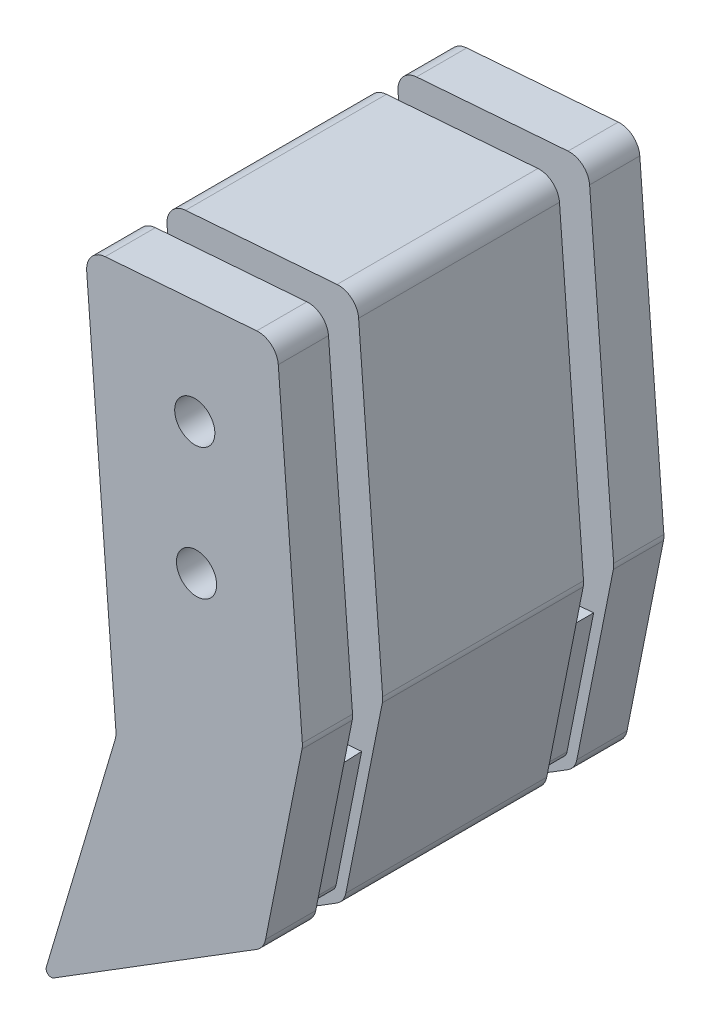
from build123d import *

# Parameters (mm, degrees)
EXTRUDE_1_DEPTH     = 36
SKETCH_2_W          = 16.133790568
SKETCH_2_H          = 36
EXTRUDE_2_DEPTH     = 6
EXTRUDE_3_DEPTH     = 36
FILLET_2_R          = 0.5
FILLET_4_R          = 2
CUT_EXTRUDE_START   = -4
CUT_EXTRUDE_1_DEPTH = 4
CUT_EXTRUDE_2_DEPTH = 60.648936936
CUT_EXTRUDE_4_DEPTH = 60.648936936
SKETCH_10_R         = 2
CUT_EXTRUDE_5_DEPTH = 292.913162357
SKETCH_11_R         = 2
EXTRUDE_6_DEPTH     = 1
EXTRUDE_START       = 1
SKETCH_12_R         = 2
EXTRUDE_7_DEPTH     = 1


with BuildPart() as part:
    # 草图1 → 凸台-拉伸1 (new body)
    with BuildSketch(Plane.XY):
        Polygon((299.097748252, 57.483280844), (301.735697168, 22.832042919), (294.730758259, 0), (313.442305989, 11.635922746), (317.295860503, 30.980257384), (315.184988901, 58.707979342), align=None)
    extrude(amount=EXTRUDE_1_DEPTH)

    # 草图2 → 凸台-拉伸2 (add)
    with BuildSketch(Plane(origin=(-2.627453617, 34.513375093, 0), x_dir=(0.9971147561793038, 0.07590891258269725, 0), z_dir=(-0.07590891258269725, 0.9971147561793038, 0))):
        with Locations((310.665166947, -18)):
            Rectangle(SKETCH_2_W, SKETCH_2_H)
    extrude(amount=EXTRUDE_2_DEPTH)

    # 草图3 → 凸台-拉伸3 (add)
    with BuildSketch(Plane.XY.offset(36)):
        Polygon((298.642294776, 63.465969381), (301.735697168, 22.832042919), (294.730758259, 0), (291.40566003, -2.067738419), (298.7443529, 22.604316182), (295.650950508, 63.238242643), align=None)
    extrude(amount=-EXTRUDE_3_DEPTH)

    # 圆角2
    fillet_2_edges = [part.edges().sort_by_distance(p)[0] for p in [
        (291.40566003, -2.067738419, 18),
    ]]
    fillet(fillet_2_edges, radius=FILLET_2_R)

    # 圆角4
    fillet_4_edges = [part.edges().sort_by_distance(p)[0] for p in [
        (317.295860503, 30.980257384, 18),
        (313.442305989, 11.635922746, 18),
        (314.729535426, 64.690667879, 18),
        (298.7443529, 22.604316182, 18),
        (295.650950508, 63.238242643, 18),
    ]]
    fillet(fillet_4_edges, radius=FILLET_4_R)

    # 草图4 → 切除-拉伸1 (cut)
    with BuildSketch(Plane.XY.offset(31).offset(CUT_EXTRUDE_START)):
        with BuildLine():
            Line((292.524622126, -1.371903061), (312.706326829, 11.178248331))
            ThreePointArc((312.706326829, 11.178248331), (313.294550919, 11.738215234), (313.61162859, 12.485899834))
            Line((313.61162859, 12.485899834), (317.242267225, 30.711226207))
            ThreePointArc((317.242267225, 30.711226207), (317.277169716, 30.981386297), (317.27503737, 31.253783271))
            Line((317.27503737, 31.253783271), (314.881353251, 62.696438367))
            ThreePointArc((314.881353251, 62.696438367), (314.189905536, 64.062105166), (312.735305913, 64.538850054))
            Line((312.735305913, 64.538850054), (297.64518002, 63.390060468))
            ThreePointArc((297.64518002, 63.390060468), (296.27951322, 62.698612754), (295.802768333, 61.244013131))
            Line((295.802768333, 61.244013131), (298.716326749, 22.972458573))
            ThreePointArc((298.716326749, 22.972458573), (298.710751525, 22.607910585), (298.639090177, 22.250431957))
            Line((298.639090177, 22.250431957), (291.781334489, -0.804753178))
            ThreePointArc((291.781334489, -0.804753178), (291.957278491, -1.344805743), (292.524622126, -1.371903061))
        make_face()
        with BuildLine():
            Line((312.811214826, 63.541735298), (297.721088933, 62.392945712))
            ThreePointArc((297.721088933, 62.392945712), (297.038255533, 62.047221855), (296.799883089, 61.319922043))
            Line((296.799883089, 61.319922043), (299.713441505, 23.048367486))
            ThreePointArc((299.713441505, 23.048367486), (299.705078669, 22.501545504), (299.597586647, 21.965327561))
            Line((299.597586647, 21.965327561), (293.115505419, 0.173127667))
            Line((293.115505419, 0.173127667), (312.178248026, 12.027443702))
            ThreePointArc((312.178248026, 12.027443702), (312.472360071, 12.307427153), (312.630898906, 12.681269453))
            Line((312.630898906, 12.681269453), (316.261537541, 30.906595826))
            ThreePointArc((316.261537541, 30.906595826), (316.278988787, 31.041675872), (316.277922614, 31.177874358))
            Line((316.277922614, 31.177874358), (313.884238495, 62.620529454))
            ThreePointArc((313.884238495, 62.620529454), (313.538514637, 63.303362854), (312.811214826, 63.541735298))
        make_face(mode=Mode.SUBTRACT)
    cut_extrude_1 = extrude(amount=CUT_EXTRUDE_1_DEPTH, mode=Mode.SUBTRACT)

    # 镜向1: 切除-拉伸1 across plane
    add(cut_extrude_1.mirror(Plane.XY.offset(18)), mode=Mode.SUBTRACT)

    # 草图5 → 切除-拉伸2 (cut, through all)
    with BuildSketch(Plane(origin=(316.815327762, 24.118695337, 0), x_dir=(0, 0, -1), z_dir=(0.9971147561793037, 0.07590891258269838, 0))):
        Polygon((-9, 29.005921915), (-5, 29.005921915), (-5, 7.07960541), (-5, 1.984059182), (-9, 1.984059182), (-9, 7.07960541), align=None)
        with BuildLine():
            Line((-31, 29.005921915), (-31, 7.07960541))
            Line((-31, 7.07960541), (-31, 1.327664424))
            ThreePointArc((-31, 1.327664424), (-29.000294628, 1.441652043), (-27, 1.544783774))
            Line((-27, 1.544783774), (-27, 7.07960541))
            Line((-27, 7.07960541), (-27, 29.005921915))
            Line((-27, 29.005921915), (-31, 29.005921915))
        make_face()
    extrude(amount=-CUT_EXTRUDE_2_DEPTH, mode=Mode.SUBTRACT)

    # 草图9 → 切除-拉伸4 (cut, through all)
    with BuildSketch(Plane(origin=(316.815327762, 24.118695337, 0), x_dir=(0, 0, -1), z_dir=(0.9971147561793037, 0.07590891258269838, 0))):
        Polygon((-9, 38.613242737), (-9, 41.460309821), (-5, 41.460309821), (-5, 38.613242737), (-5, 29.005921915), (-9, 29.005921915), align=None)
        Polygon((-31, 38.613242737), (-31, 44.422842446), (-27, 44.422842446), (-27, 38.613242737), (-27, 29.005921915), (-31, 29.005921915), align=None)
    extrude(amount=-CUT_EXTRUDE_4_DEPTH, mode=Mode.SUBTRACT)

    # 草图10 → 切除-拉伸5 (cut, through all)
    with BuildSketch(Plane(origin=(66.866773871, -81.092277049, 36), x_dir=(0.7883945685937017, 0.6151698986556081, 0), z_dir=(0, 0, 1))):
        with Locations(Location((264.00053068, -51.596816089, 0), (0, 0, 322.035733535))):
            Circle(SKETCH_10_R)
        with Locations(Location((271.852922924, -41.244744086, 0), (0, 0, 322.035733535))):
            Circle(SKETCH_10_R)
    extrude(amount=-CUT_EXTRUDE_5_DEPTH, mode=Mode.SUBTRACT)

    # 草图11 → 凸台-拉伸6 (add)
    with BuildSketch(Plane.XY.offset(27)):
        with BuildLine():
            Line((312.735305913, 64.538850054), (297.64518002, 63.390060468))
            ThreePointArc((297.64518002, 63.390060468), (296.27951322, 62.698612754), (295.802768333, 61.244013131))
            Line((295.802768333, 61.244013131), (298.716326749, 22.972458573))
            ThreePointArc((298.716326749, 22.972458573), (298.710751525, 22.607910585), (298.639090177, 22.250431957))
            Line((298.639090177, 22.250431957), (291.781334489, -0.804753178))
            ThreePointArc((291.781334489, -0.804753178), (291.957278491, -1.344805743), (292.524622126, -1.371903061))
            Line((292.524622126, -1.371903061), (312.706326829, 11.178248331))
            ThreePointArc((312.706326829, 11.178248331), (313.294550919, 11.738215234), (313.61162859, 12.485899834))
            Line((313.61162859, 12.485899834), (317.242267225, 30.711226207))
            ThreePointArc((317.242267225, 30.711226207), (317.277169716, 30.981386297), (317.27503737, 31.253783271))
            Line((317.27503737, 31.253783271), (314.881353251, 62.696438367))
            ThreePointArc((314.881353251, 62.696438367), (314.189905536, 64.062105166), (312.735305913, 64.538850054))
        make_face()
        with Locations((306.74416649, 40.634253093)):
            Circle(SKETCH_11_R, mode=Mode.SUBTRACT)
        with Locations((306.5666668, 53.626325775)):
            Circle(SKETCH_11_R, mode=Mode.SUBTRACT)
    extrude(amount=EXTRUDE_6_DEPTH)

    # 草图12 → 凸台-拉伸7 (add)
    with BuildSketch(Plane(origin=(0, 0, 9), x_dir=(-1, 0, 0), z_dir=(0, 0, -1)).offset(EXTRUDE_START)):
        with BuildLine():
            Line((-298.716326749, 22.972458573), (-295.802768333, 61.244013131))
            ThreePointArc((-295.802768333, 61.244013131), (-296.27951322, 62.698612754), (-297.64518002, 63.390060468))
            Line((-297.64518002, 63.390060468), (-312.735305913, 64.538850054))
            ThreePointArc((-312.735305913, 64.538850054), (-314.189905536, 64.062105166), (-314.881353251, 62.696438367))
            Line((-314.881353251, 62.696438367), (-317.27503737, 31.253783271))
            ThreePointArc((-317.27503737, 31.253783271), (-317.277169716, 30.981386297), (-317.242267225, 30.711226207))
            Line((-317.242267225, 30.711226207), (-313.61162859, 12.485899834))
            ThreePointArc((-313.61162859, 12.485899834), (-313.294550919, 11.738215234), (-312.706326829, 11.178248331))
            Line((-312.706326829, 11.178248331), (-292.524622126, -1.371903061))
            ThreePointArc((-292.524622126, -1.371903061), (-291.957278491, -1.344805743), (-291.781334489, -0.804753178))
            Line((-291.781334489, -0.804753178), (-298.639090177, 22.250431957))
            ThreePointArc((-298.639090177, 22.250431957), (-298.710751525, 22.607910585), (-298.716326749, 22.972458573))
        make_face()
        with Locations(Location((-306.74416649, 40.634253093, 0), (0, 0, 180))):
            Circle(SKETCH_12_R, mode=Mode.SUBTRACT)
        with Locations(Location((-306.5666668, 53.626325775, 0), (0, 0, 180))):
            Circle(SKETCH_12_R, mode=Mode.SUBTRACT)
    extrude(amount=-EXTRUDE_7_DEPTH)


solid = part.part
